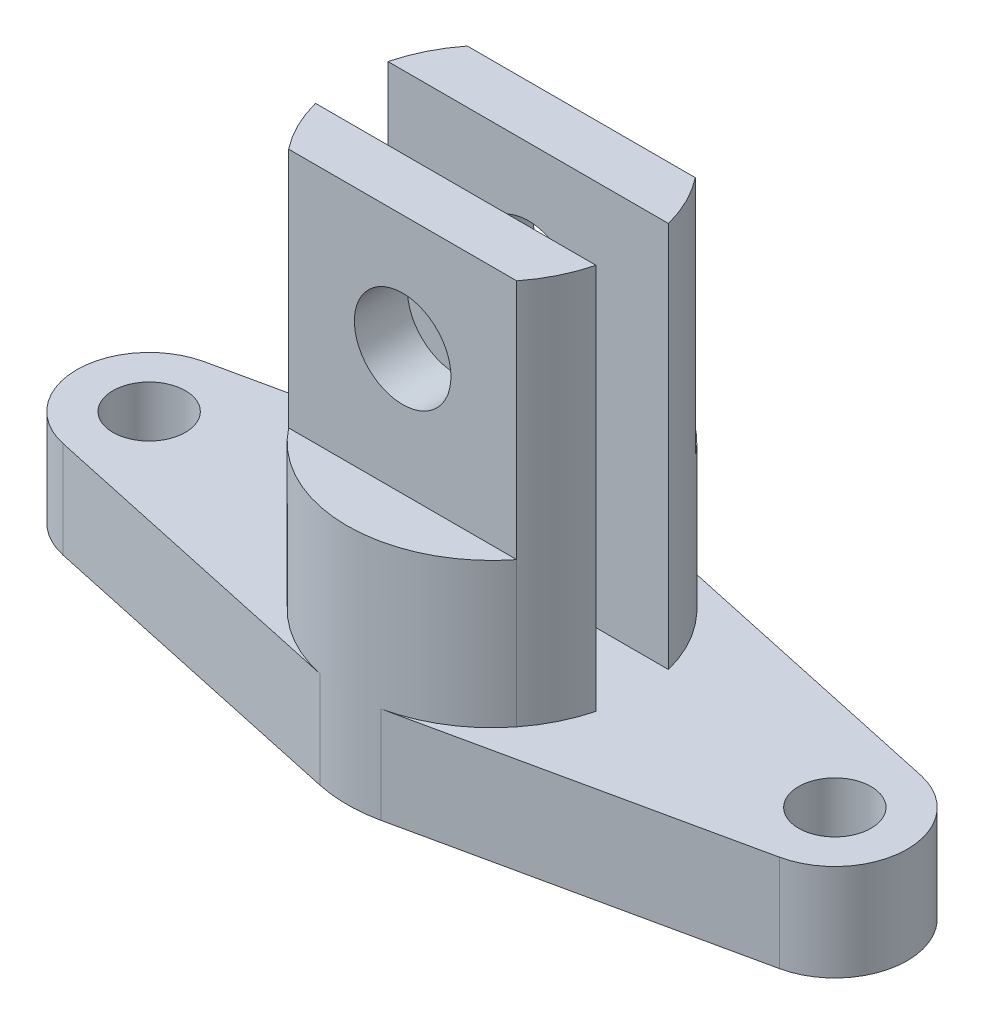
from build123d import *

# Parameters (mm, degrees)
CROQUIS1_R              = 7.5
SALIENTE_EXTRUIR2_DEPTH = 20
SALIENTE_EXTRUIR3_DEPTH = 30
SALIENTE_EXTRUIR4_DEPTH = 80
CROQUIS4_R              = 10
CORTAR_EXTRUIR1_DEPTH   = 141.528466867


with BuildPart() as part:
    # Croquis1 → Saliente-Extruir2 (new body)
    # profile 1 of 7: a face of its own
    with BuildSketch(Plane(origin=(0, 0, 0), x_dir=(1, 0, 0), z_dir=(0, 1, 0))):
        with BuildLine():
            Line((74.169014085, 14.661423864), (6.338028169, 29.322847729))
            ThreePointArc((6.338028169, 29.322847729), (15.924993338, 25.424291282), (23.616731357, 18.5))
            ThreePointArc((23.616731357, 18.5), (26.900316488, 13.280548665), (29.047375097, 7.5))
            ThreePointArc((29.047375097, 7.5), (29.760890888, 3.780128774), (30, 0))
            ThreePointArc((30, 0), (29.760890888, -3.780128774), (29.047375097, -7.5))
            ThreePointArc((29.047375097, -7.5), (26.900316488, -13.280548665), (23.616731357, -18.5))
            ThreePointArc((23.616731357, -18.5), (15.924993338, -25.424291282), (6.338028169, -29.322847729))
            Line((6.338028169, -29.322847729), (74.169014085, -14.661423864))
            ThreePointArc((74.169014085, -14.661423864), (86, 0), (74.169014085, 14.661423864))
        make_face()
        with Locations(Location((71, 0, 0), (0, 0, 270))):
            Circle(CROQUIS1_R, mode=Mode.SUBTRACT)
    # profile 2 of 7: a face of its own
    with BuildSketch(Plane(origin=(0, 0, 0), x_dir=(1, 0, 0), z_dir=(0, 1, 0))):
        with BuildLine():
            ThreePointArc((-29.047375097, -7.5), (-26.900316488, -13.280548665), (-23.616731357, -18.5))
            Line((-23.616731357, -18.5), (23.616731357, -18.5))
            ThreePointArc((23.616731357, -18.5), (26.900316488, -13.280548665), (29.047375097, -7.5))
            Line((29.047375097, -7.5), (-29.047375097, -7.5))
        make_face()
    # profile 3 of 7: a face of its own
    with BuildSketch(Plane(origin=(0, 0, 0), x_dir=(1, 0, 0), z_dir=(0, 1, 0))):
        with BuildLine():
            ThreePointArc((-23.616731357, -18.5), (-15.924993338, -25.424291282), (-6.338028169, -29.322847729))
            ThreePointArc((-6.338028169, -29.322847729), (0, -30), (6.338028169, -29.322847729))
            ThreePointArc((6.338028169, -29.322847729), (15.924993338, -25.424291282), (23.616731357, -18.5))
            Line((23.616731357, -18.5), (-23.616731357, -18.5))
        make_face()
    # profile 4 of 7: a face of its own
    with BuildSketch(Plane(origin=(0, 0, 0), x_dir=(1, 0, 0), z_dir=(0, 1, 0))):
        with BuildLine():
            Line((29.047375097, 7.5), (-29.047375097, 7.5))
            ThreePointArc((-29.047375097, 7.5), (-30, 0), (-29.047375097, -7.5))
            Line((-29.047375097, -7.5), (29.047375097, -7.5))
            ThreePointArc((29.047375097, -7.5), (29.760890888, -3.780128774), (30, 0))
            ThreePointArc((30, 0), (29.760890888, 3.780128774), (29.047375097, 7.5))
        make_face()
    # profile 5 of 7: a face of its own
    with BuildSketch(Plane(origin=(0, 0, 0), x_dir=(1, 0, 0), z_dir=(0, 1, 0))):
        with BuildLine():
            Line((23.616731357, 18.5), (-23.616731357, 18.5))
            ThreePointArc((-23.616731357, 18.5), (-26.900316488, 13.280548665), (-29.047375097, 7.5))
            Line((-29.047375097, 7.5), (29.047375097, 7.5))
            ThreePointArc((29.047375097, 7.5), (26.900316488, 13.280548665), (23.616731357, 18.5))
        make_face()
    # profile 6 of 7: a face of its own
    with BuildSketch(Plane(origin=(0, 0, 0), x_dir=(1, 0, 0), z_dir=(0, 1, 0))):
        with BuildLine():
            ThreePointArc((6.338028169, 29.322847729), (0, 30), (-6.338028169, 29.322847729))
            ThreePointArc((-6.338028169, 29.322847729), (-15.924993338, 25.424291282), (-23.616731357, 18.5))
            Line((-23.616731357, 18.5), (23.616731357, 18.5))
            ThreePointArc((23.616731357, 18.5), (15.924993338, 25.424291282), (6.338028169, 29.322847729))
        make_face()
    # profile 7 of 7: a face of its own
    with BuildSketch(Plane(origin=(0, 0, 0), x_dir=(1, 0, 0), z_dir=(0, 1, 0))):
        with BuildLine():
            Line((-6.338028169, 29.322847729), (-74.169014085, 14.661423864))
            ThreePointArc((-74.169014085, 14.661423864), (-86, 0), (-74.169014085, -14.661423864))
            Line((-74.169014085, -14.661423864), (-6.338028169, -29.322847729))
            ThreePointArc((-6.338028169, -29.322847729), (-15.924993338, -25.424291282), (-23.616731357, -18.5))
            ThreePointArc((-23.616731357, -18.5), (-26.900316488, -13.280548665), (-29.047375097, -7.5))
            ThreePointArc((-29.047375097, -7.5), (-30, 0), (-29.047375097, 7.5))
            ThreePointArc((-29.047375097, 7.5), (-26.900316488, 13.280548665), (-23.616731357, 18.5))
            ThreePointArc((-23.616731357, 18.5), (-15.924993338, 25.424291282), (-6.338028169, 29.322847729))
        make_face()
        with Locations(Location((-71, 0, 0), (0, 0, 270))):
            Circle(CROQUIS1_R, mode=Mode.SUBTRACT)
    extrude(amount=SALIENTE_EXTRUIR2_DEPTH)

    # Croquis2 → Saliente-Extruir3 (add)
    with BuildSketch(Plane(origin=(0, 20, 0), x_dir=(1, 0, 0), z_dir=(0, 1, 0))):
        with BuildLine():
            Line((-23.616731357, 18.5), (23.616731357, 18.5))
            ThreePointArc((23.616731357, 18.5), (0, 30), (-23.616731357, 18.5))
        make_face()
        with BuildLine():
            Line((-23.616731357, -18.5), (23.616731357, -18.5))
            ThreePointArc((23.616731357, -18.5), (0, -30), (-23.616731357, -18.5))
        make_face()
    extrude(amount=SALIENTE_EXTRUIR3_DEPTH)

    # Croquis3 → Saliente-Extruir4 (add)
    with BuildSketch(Plane(origin=(0, 20, 0), x_dir=(1, 0, 0), z_dir=(0, 1, 0))):
        with BuildLine():
            ThreePointArc((-23.616731357, 18.5), (-26.900316488, 13.280548665), (-29.047375097, 7.5))
            Line((-29.047375097, 7.5), (29.047375097, 7.5))
            ThreePointArc((29.047375097, 7.5), (26.900316488, 13.280548665), (23.616731357, 18.5))
            Line((23.616731357, 18.5), (-23.616731357, 18.5))
        make_face()
        with BuildLine():
            Line((-29.047375097, -7.5), (29.047375097, -7.5))
            ThreePointArc((29.047375097, -7.5), (26.900316391, -13.280548617), (23.616731357, -18.5))
            Line((23.616731357, -18.5), (-23.616731357, -18.5))
            ThreePointArc((-23.616731357, -18.5), (-26.900316488, -13.280548665), (-29.047375097, -7.5))
        make_face()
    extrude(amount=SALIENTE_EXTRUIR4_DEPTH)

    # Croquis4 → Cortar-Extruir1 (cut, through all)
    with BuildSketch(Plane.XY.offset(18.5)):
        with Locations((0, 76)):
            Circle(CROQUIS4_R)
    extrude(amount=-CORTAR_EXTRUIR1_DEPTH, mode=Mode.SUBTRACT)


solid = part.part
